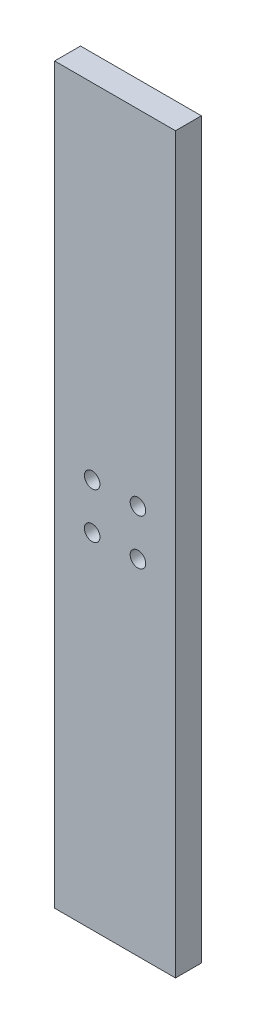
from build123d import *

# Parameters (mm, degrees)
SKETCH1_W           = 14
SKETCH1_H           = 85
SKETCH1_R           = 0.9
BOSS_EXTRUDE1_DEPTH = 3


with BuildPart() as part:
    # Sketch1 → Boss-Extrude1 (new body)
    with BuildSketch(Plane.XY):
        Rectangle(SKETCH1_W, SKETCH1_H)
        with Locations((2.651650429, -2.651650429)):
            Circle(SKETCH1_R, mode=Mode.SUBTRACT)
        with Locations((-2.651650429, -2.651650429)):
            Circle(SKETCH1_R, mode=Mode.SUBTRACT)
        with Locations((-2.651650429, 2.651650429)):
            Circle(SKETCH1_R, mode=Mode.SUBTRACT)
        with Locations((2.651650429, 2.651650429)):
            Circle(SKETCH1_R, mode=Mode.SUBTRACT)
    extrude(amount=BOSS_EXTRUDE1_DEPTH)


solid = part.part
